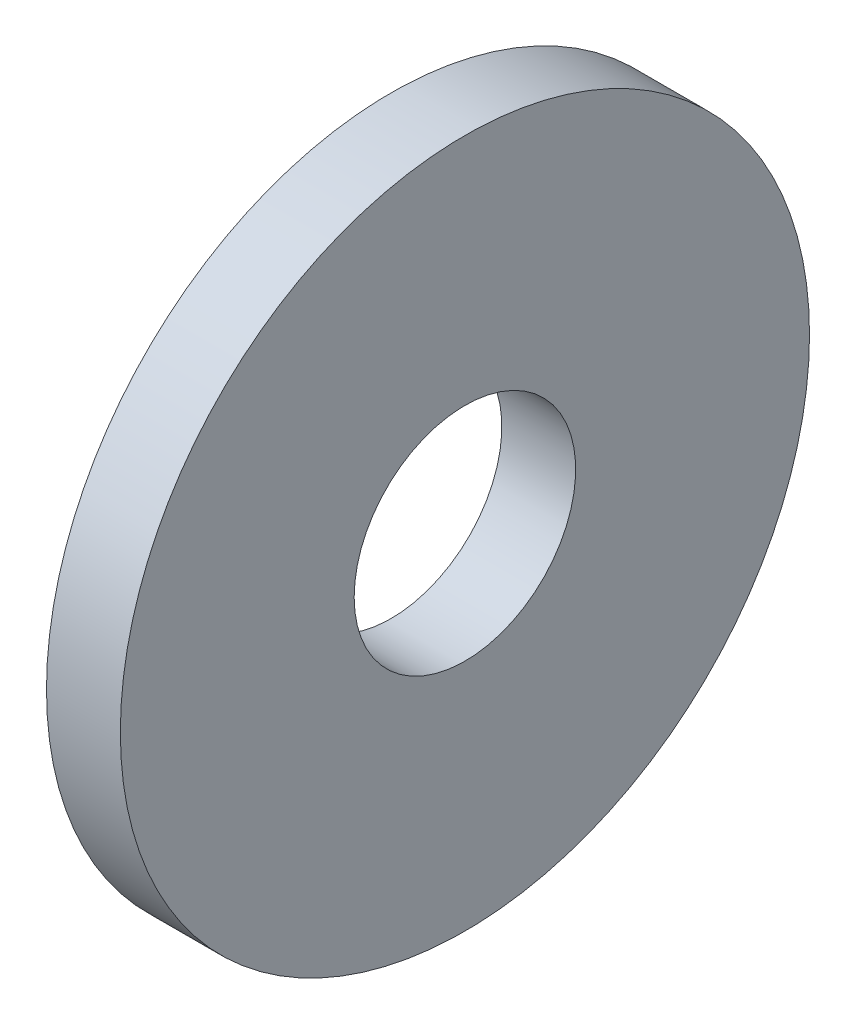
from build123d import *

# Parameters (mm, degrees)
SKETCH1_W = 3
SKETCH1_H = 9.5


with BuildPart() as part:
    # Sketch1 → Base-Revolve (revolve)
    with BuildSketch(Plane.XY, mode=Mode.PRIVATE) as base_revolve_sk:
        with Locations((-1.5, 9.25)):
            Rectangle(SKETCH1_W, SKETCH1_H)
    revolve(base_revolve_sk.sketch.rotate(Axis((-34.925, 0, 0), (1, 0, 0)), 90), axis=Axis((-34.925, 0, 0), (1, 0, 0)))


solid = part.part
